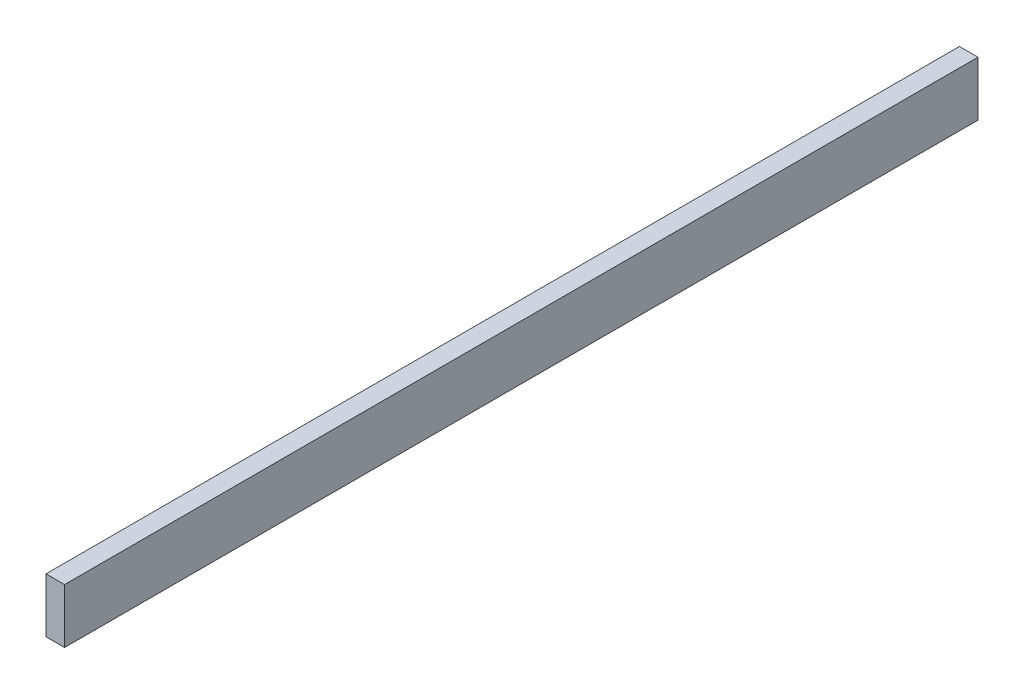
from build123d import *

# Parameters (mm, degrees)
SKETCH1_W           = 20.32
SKETCH1_H           = 59.69
BOSS_EXTRUDE1_DEPTH = 1000


with BuildPart() as part:
    # Sketch1 → Boss-Extrude1 (new body)
    with BuildSketch(Plane.XY):
        Rectangle(SKETCH1_W, SKETCH1_H)
    extrude(amount=BOSS_EXTRUDE1_DEPTH)


solid = part.part
